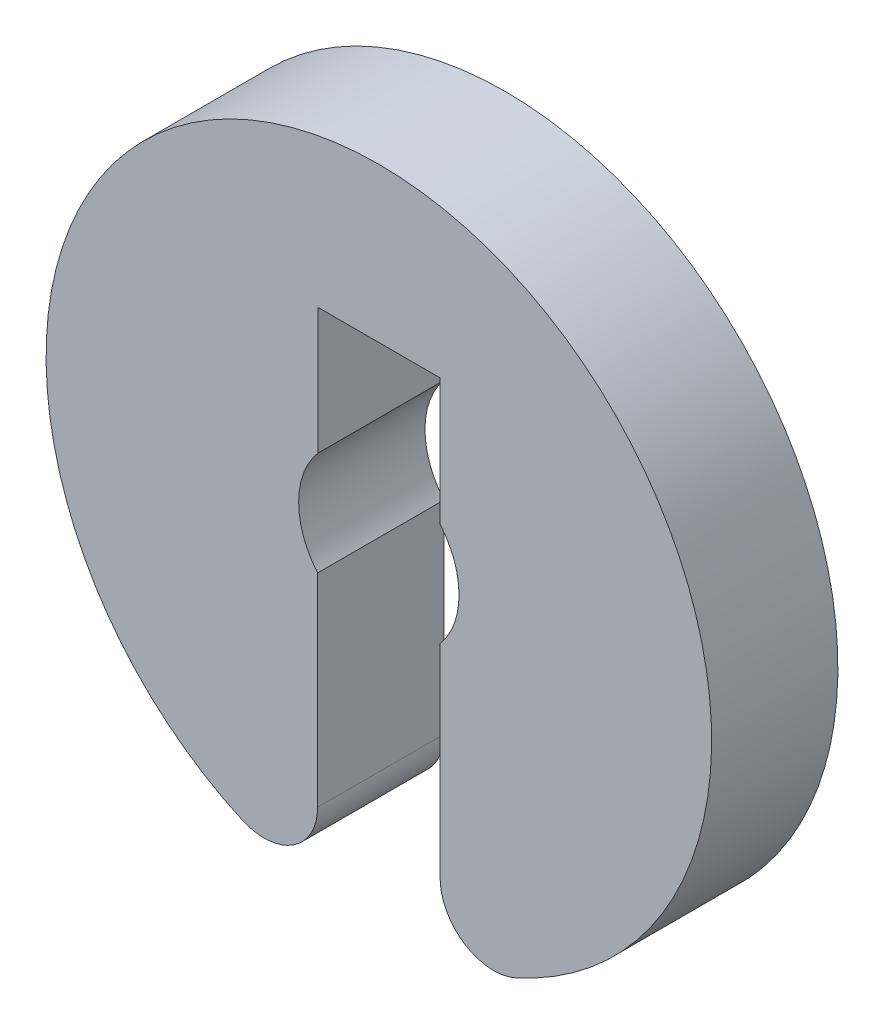
from build123d import *

# Parameters (mm, degrees)
EXTRUDE_1_DEPTH = 3
FILLET_1_R      = 1.27


with BuildPart() as part:
    # 스케치1 → 보스-돌출1 (new body)
    with BuildSketch(Plane.XY):
        with BuildLine():
            Line((-1.4475, 4.238454178), (1.4475, 4.238454178))
            Line((1.4475, 4.238454178), (1.4475, 1.238454178))
            ThreePointArc((1.4475, 1.238454178), (1.904991204, 0.005788867), (1.455, -1.229634092))
            Line((1.455, -1.229634092), (1.455, -7.769942085))
            ThreePointArc((1.455, -7.769942085), (0, 7.905), (-1.455, -7.769942085))
            Line((-1.455, -7.769942085), (-1.455, -1.229634092))
            ThreePointArc((-1.455, -1.229634092), (-1.904991204, 0.005788867), (-1.4475, 1.238454178))
            Line((-1.4475, 1.238454178), (-1.4475, 4.238454178))
        make_face()
    extrude(amount=EXTRUDE_1_DEPTH)

    # 필렛1
    fillet_1_edges = [part.edges().sort_by_distance(p)[0] for p in [
        (-1.455, -7.769942085, 1.5),
        (1.455, -7.769942085, 1.5),
    ]]
    fillet(fillet_1_edges, radius=FILLET_1_R)


solid = part.part
